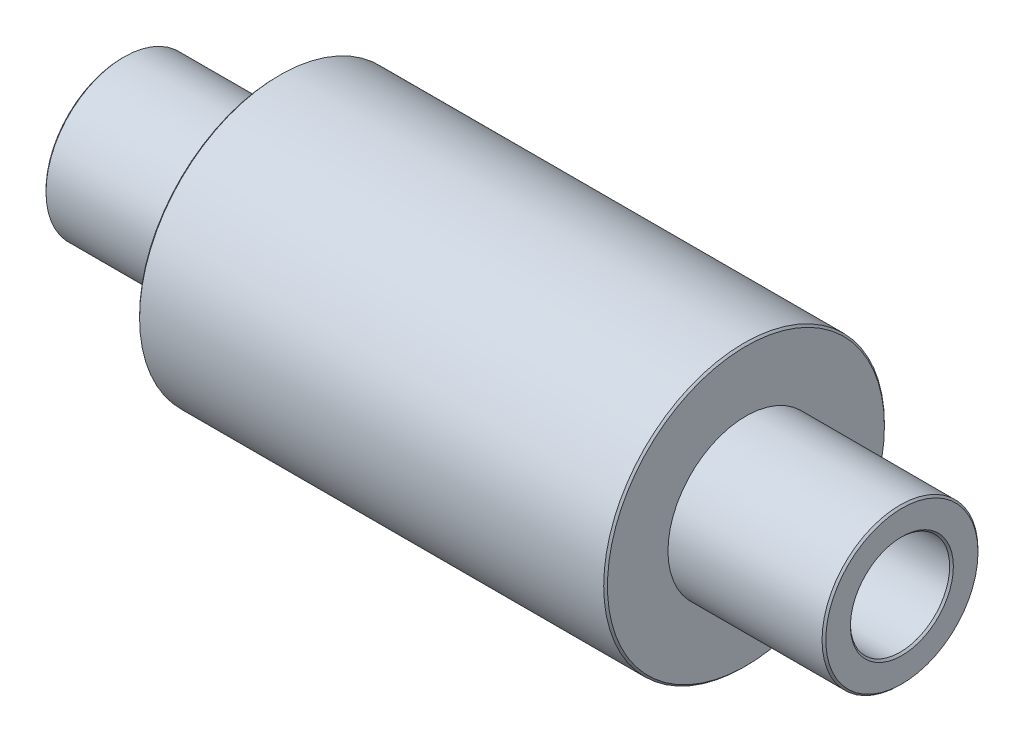
from build123d import *

# Parameters (mm, degrees)
SKETCH34_R                  = 5.715
BOSS_EXTRUDE2_DEPTH         = 15.875
F_21_0_159_DIAMETER_HOLE2_D = 4.0386
SKETCH39_W                  = 6.35
SKETCH39_H                  = 2.54
CHAMFER1_SIZE               = 0.0762
CHAMFER2_SIZE               = 0.0762
CHAMFER8_SIZE               = 0.0762


with BuildPart() as part:
    # Sketch34 → Boss-Extrude2 (new, symmetric)
    with BuildSketch(Plane(origin=(0, 0, 0), x_dir=(0, 0, -1), z_dir=(1, 0, 0))):
        Circle(SKETCH34_R)
    extrude(amount=BOSS_EXTRUDE2_DEPTH, both=True)

    # #21 (0.159) Diameter Hole2 (through all)
    with Locations(Plane(origin=(15.875, 0, 0), x_dir=(0, 0, -1), z_dir=(1, 0, 0))):
        with Locations((0, 0)):
            Hole(F_21_0_159_DIAMETER_HOLE2_D / 2)

    # Sketch39 → Cut-Revolve1 (revolve, cut)
    with BuildSketch(Plane.XY, mode=Mode.PRIVATE) as cut_revolve1_sk:
        with Locations((12.7, 4.445)):
            Rectangle(SKETCH39_W, SKETCH39_H)
    cut_revolve1 = revolve(cut_revolve1_sk.sketch.rotate(Axis((0, 0, 0), (1, 0, 0)), 90), axis=Axis((0, 0, 0), (1, 0, 0)), mode=Mode.SUBTRACT)

    # Chamfer1
    chamfer1_edges = [part.edges().sort_by_distance(p)[0] for p in [
        (15.875, 0, -3.175),
        (9.525, 0, 5.715),
    ]]
    chamfer(chamfer1_edges, length=CHAMFER1_SIZE)

    # Mirror1: Cut-Revolve1 across plane
    add(cut_revolve1.mirror(Plane(origin=(0, 0, 0), x_dir=(0, 0, 1), z_dir=(1, 0, 0))), mode=Mode.SUBTRACT)

    # Chamfer2
    chamfer2_edges = [part.edges().sort_by_distance(p)[0] for p in [
        (-15.875, 0, -3.175),
        (-9.525, 0, 5.715),
    ]]
    chamfer(chamfer2_edges, length=CHAMFER2_SIZE)

    # Chamfer8
    chamfer8_edges = [part.edges().sort_by_distance(p)[0] for p in [
        (15.875, 0, -2.0193),
        (-15.875, 0, -2.0193),
    ]]
    chamfer(chamfer8_edges, length=CHAMFER8_SIZE)


solid = part.part
